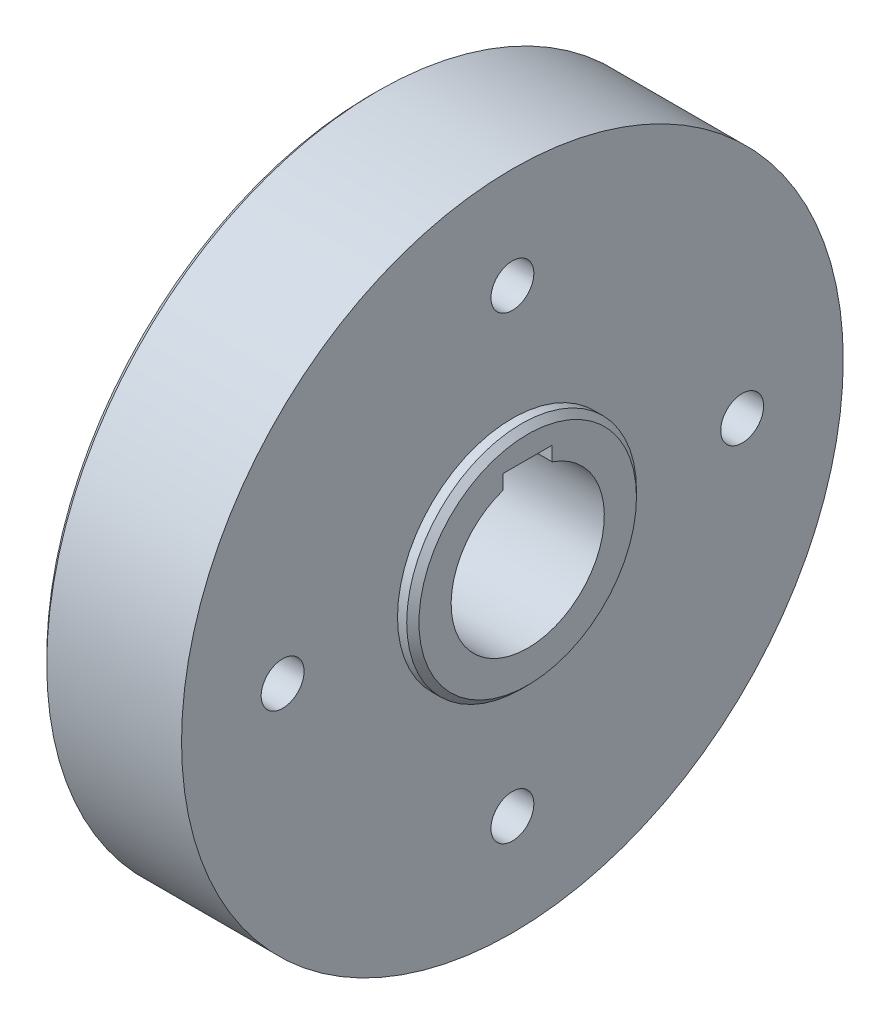
from build123d import *

# Parameters (mm, degrees)
M16X2_0_TAPPED_HOLE1_D = 14
SKETCH4_W              = 21
SKETCH4_H              = 8
CUT_EXTRUDE1_DEPTH     = 8
CHAMFER2_SIZE          = 2


with BuildPart() as part:
    # Sketch1 → Revolve1 (revolve)
    with BuildSketch(Plane.XY, mode=Mode.PRIVATE) as revolve1_sk:
        Polygon((-40, 25), (40, 25), (45, 25), (45, 37.5), (40, 37.5), (40, 108), (15, 108), (15, 50), (-40, 50), align=None)
    revolve(revolve1_sk.sketch.rotate(Axis((-40, 0, 0), (1, 0, 0)), 90), axis=Axis((-40, 0, 0), (1, 0, 0)))

    # M16x2.0 Tapped Hole1 (through all)
    with Locations(Plane(origin=(40, 0, 0), x_dir=(0, 0, -1), z_dir=(1, 0, 0))):
        with Locations((-75, 0), (0, 75), (75, 0), (0, -75)):
            Hole(M16X2_0_TAPPED_HOLE1_D / 2)

    # Sketch4 → Revolve2 (revolve)
    with BuildSketch(Plane.XY, mode=Mode.PRIVATE) as revolve2_sk:
        with Locations((4.5, 104)):
            Rectangle(SKETCH4_W, SKETCH4_H)
    revolve(revolve2_sk.sketch.rotate(Axis((0, 0, 0), (1, 0, 0)), 90), axis=Axis((0, 0, 0), (1, 0, 0)))

    # Sketch5 → Cut-Extrude1 (cut, symmetric)
    with BuildSketch(Plane.XY):
        Polygon((-40, 0), (45, 0), (45, 28.4), (-40, 27.55), align=None)
    extrude(amount=CUT_EXTRUDE1_DEPTH, both=True, mode=Mode.SUBTRACT)

    # Chamfer2
    chamfer2_edges = [part.edges().sort_by_distance(p)[0] for p in [
        (45, 0, -37.5),
        (-6, 0, -108),
        (-40, 0, -50),
        (15, 0, -50),
    ]]
    chamfer(chamfer2_edges, length=CHAMFER2_SIZE)


solid = part.part
